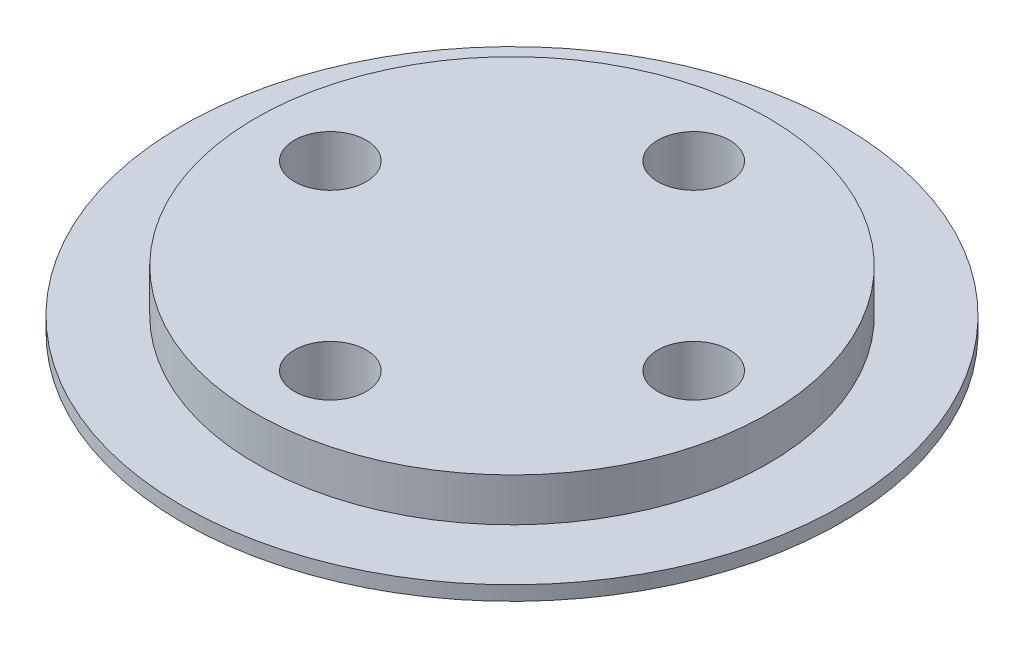
from build123d import *

# Parameters (mm, degrees)
SKETCH_3_R          = 12.5
CUT_EXTRUDE_1_DEPTH = 164.157898981


with BuildPart() as part:
    # 草圖2 → 旋轉1 (revolve)
    with BuildSketch(Plane.XY, mode=Mode.PRIVATE) as revolve_1_sk:
        Polygon((0, 0), (0, 20), (89, 20), (89, 5), (114.5, 5), (114.5, 0), align=None)
    revolve(revolve_1_sk.sketch.rotate(Axis((0, 0, 0), (0, 1, 0)), 90), axis=Axis((0, 0, 0), (0, 1, 0)))

    # 草圖3 → 除料-伸長1 (cut, through all)
    with BuildSketch(Plane(origin=(0, 20, 0), x_dir=(1, 0, 0), z_dir=(0, 1, 0))):
        with Locations(Location((0, 63.124852982, 0), (0, 0, 270))):
            Circle(SKETCH_3_R)
        with Locations(Location((63.124852982, 0, 0), (0, 0, 270))):
            Circle(SKETCH_3_R)
        with Locations(Location((0, -63.124852982, 0), (0, 0, 270))):
            Circle(SKETCH_3_R)
        with Locations(Location((-63.124852982, 0, 0), (0, 0, 270))):
            Circle(SKETCH_3_R)
    extrude(amount=-CUT_EXTRUDE_1_DEPTH, mode=Mode.SUBTRACT)


solid = part.part
